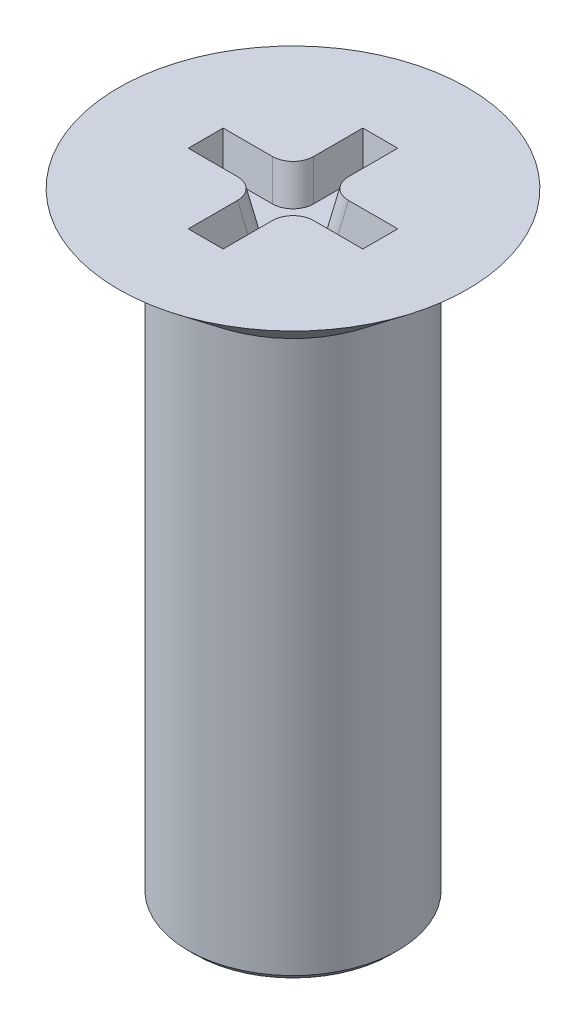
from build123d import *

# Parameters (mm, degrees)
SKETCH_2_R                    = 1.5
EXTRUDE_1_DEPTH               = 8
CHAMFER_1_SIZE                = 0.1
SKETCH_3_W                    = 2.5
SKETCH_3_H                    = 0.5
CUT_EXTRUDE_1_DEPTH           = 0.5
CUT_EXTRUDE_1_DRAFT           = -10
SKETCH_3_W_2                  = 0.5
SKETCH_3_H_2                  = 2.5
CUT_EXTRUDE_1_PROFILE_2_DEPTH = 0.5
CUT_EXTRUDE_1_PROFILE_2_DRAFT = -10
FILLET_1_R                    = 0.3


with BuildPart() as part:
    # 草图1 → 旋转1 (revolve)
    with BuildSketch(Plane.XY, mode=Mode.PRIVATE) as revolve_1_sk:
        Polygon((0, 0), (2.5, 0), (1.5, -0.8), (0, -0.8), align=None)
    revolve(revolve_1_sk.sketch.rotate(Axis((0, -0.8, 0), (0, 1, 0)), 90), axis=Axis((0, -0.8, 0), (0, 1, 0)))

    # 草图2 → 凸台-拉伸1 (add)
    with BuildSketch(Plane.XZ.offset(0.8)):
        with Locations(Location((0, 0, 0), (0, 0, 270))):
            Circle(SKETCH_2_R)
    extrude(amount=EXTRUDE_1_DEPTH)

    # 倒角1
    chamfer_1_edges = [part.edges().sort_by_distance(p)[0] for p in [
        (0, -8.8, 1.5),
    ]]
    chamfer(chamfer_1_edges, length=CHAMFER_1_SIZE)


with BuildPart() as cut_extrude_1_tool:
    # 草图3 → 切除-拉伸1 (with draft: the straight prism first)
    with BuildSketch(Plane(origin=(0, 0, 0), x_dir=(1, 0, 0), z_dir=(0, 1, 0))):
        Rectangle(SKETCH_3_W, SKETCH_3_H)
    extrude(amount=-CUT_EXTRUDE_1_DEPTH)
    # 切除-拉伸1: the draft: its side faces are tilted about the plane it starts from
    cut_extrude_1_sides = [cut_extrude_1_tool.faces().sort_by_distance(p)[0] for p in [
        (0, -0.25, 0.25),
        (1.25, -0.25, 0),
        (0, -0.25, -0.25),
        (-1.25, -0.25, 0),
    ]]
    draft(cut_extrude_1_sides, Plane(origin=(0, 0, 0), x_dir=(1, 0, 0), z_dir=(0, 1, 0)), CUT_EXTRUDE_1_DRAFT)


with BuildPart() as part_1:
    add(part.part)

    # 切除-拉伸1: cut by cut_extrude_1_tool
    add(cut_extrude_1_tool.part, mode=Mode.SUBTRACT)


with BuildPart() as cut_extrude_1_profile_2_tool:
    # 草图3 → 切除-拉伸1 profile 2 (with draft: the straight prism first)
    with BuildSketch(Plane(origin=(0, 0, 0), x_dir=(1, 0, 0), z_dir=(0, 1, 0))):
        Rectangle(SKETCH_3_W_2, SKETCH_3_H_2)
    extrude(amount=-CUT_EXTRUDE_1_PROFILE_2_DEPTH)
    # 切除-拉伸1 profile 2: the draft: its side faces are tilted about the plane it starts from
    cut_extrude_1_profile_2_sides = [cut_extrude_1_profile_2_tool.faces().sort_by_distance(p)[0] for p in [
        (-0.25, -0.25, 0),
        (0, -0.25, 1.25),
        (0.25, -0.25, 0),
        (0, -0.25, -1.25),
    ]]
    draft(cut_extrude_1_profile_2_sides, Plane(origin=(0, 0, 0), x_dir=(1, 0, 0), z_dir=(0, 1, 0)), CUT_EXTRUDE_1_PROFILE_2_DRAFT)


with BuildPart() as part_2:
    add(part_1.part)

    # 切除-拉伸1 profile 2: cut by cut_extrude_1_profile_2_tool
    add(cut_extrude_1_profile_2_tool.part, mode=Mode.SUBTRACT)

    # 圆角1
    fillet_1_edges = [part_2.edges().sort_by_distance(p)[0] for p in [
        (0.205918255, -0.25, -0.205918255),
        (0.205918255, -0.25, 0.205918255),
        (-0.205918255, -0.25, 0.205918255),
        (-0.205918255, -0.25, -0.205918255),
    ]]
    fillet(fillet_1_edges, radius=FILLET_1_R)


solid = part_2.part
